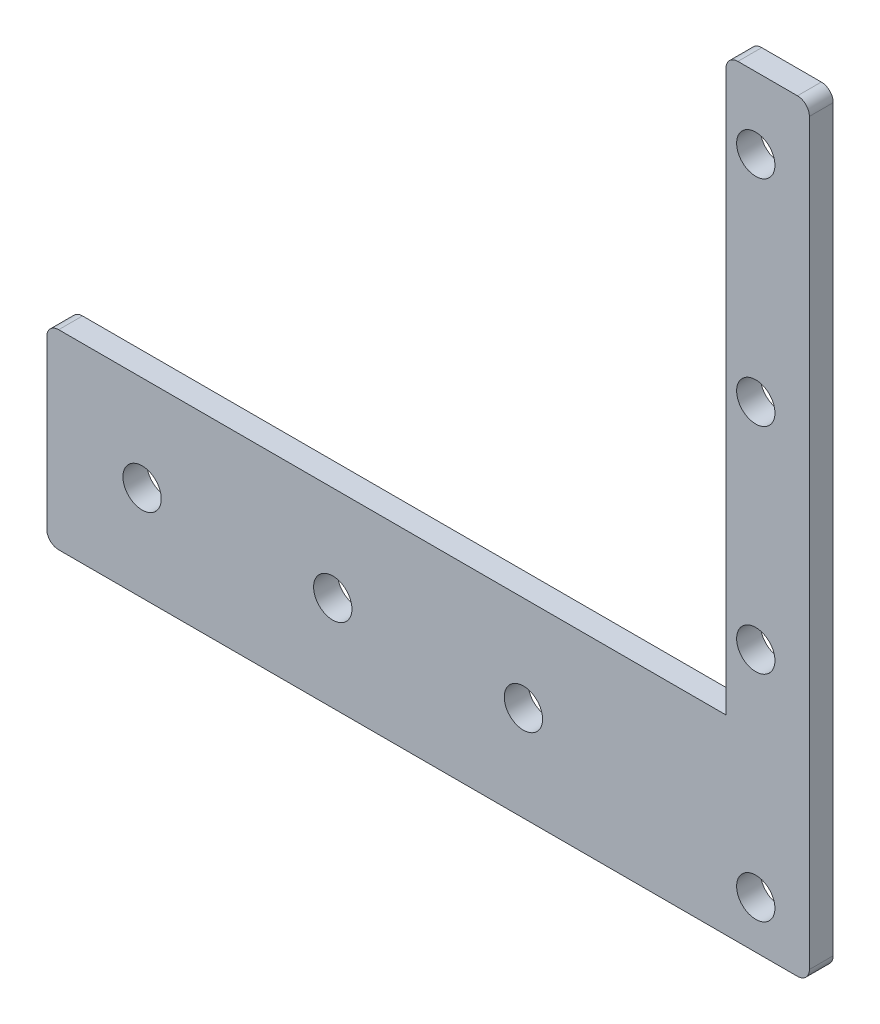
from build123d import *

# Parameters (mm, degrees)
BOSS_EXTRUDE1_DEPTH    = 3.175
F_10_CLEARANCE_HOLE1_D = 5.1054
F_10_CLEARANCE_HOLE2_D = 5.1054
FILLET1_R              = 1.5875


with BuildPart() as part:
    # Sketch1 → Boss-Extrude1 (new body)
    with BuildSketch(Plane.XY):
        Polygon((0, 0), (0, 101.6), (-11.1125, 101.6), (-11.1125, 25.4), (-101.6, 25.4), (-101.6, 0), align=None)
    extrude(amount=BOSS_EXTRUDE1_DEPTH)

    # #10 Clearance Hole1 (through all)
    with Locations(Plane.XY.offset(3.175)):
        with Locations((-7.14375, 6.35), (-7.14375, 34.925), (-7.14375, 63.5), (-7.14375, 92.075)):
            Hole(F_10_CLEARANCE_HOLE1_D / 2)

    # #10 Clearance Hole2 (through all)
    with Locations(Plane.XY.offset(3.175)):
        with Locations((-88.9, 12.7), (-38.1, 12.7), (-63.5, 12.7)):
            Hole(F_10_CLEARANCE_HOLE2_D / 2)

    # Fillet1
    fillet1_edges = [part.edges().sort_by_distance(p)[0] for p in [
        (-101.6, 0, 1.5875),
        (-101.6, 25.4, 1.5875),
        (-11.1125, 101.6, 1.5875),
        (0, 101.6, 1.5875),
        (0, 0, 1.5875),
    ]]
    fillet(fillet1_edges, radius=FILLET1_R)


solid = part.part
